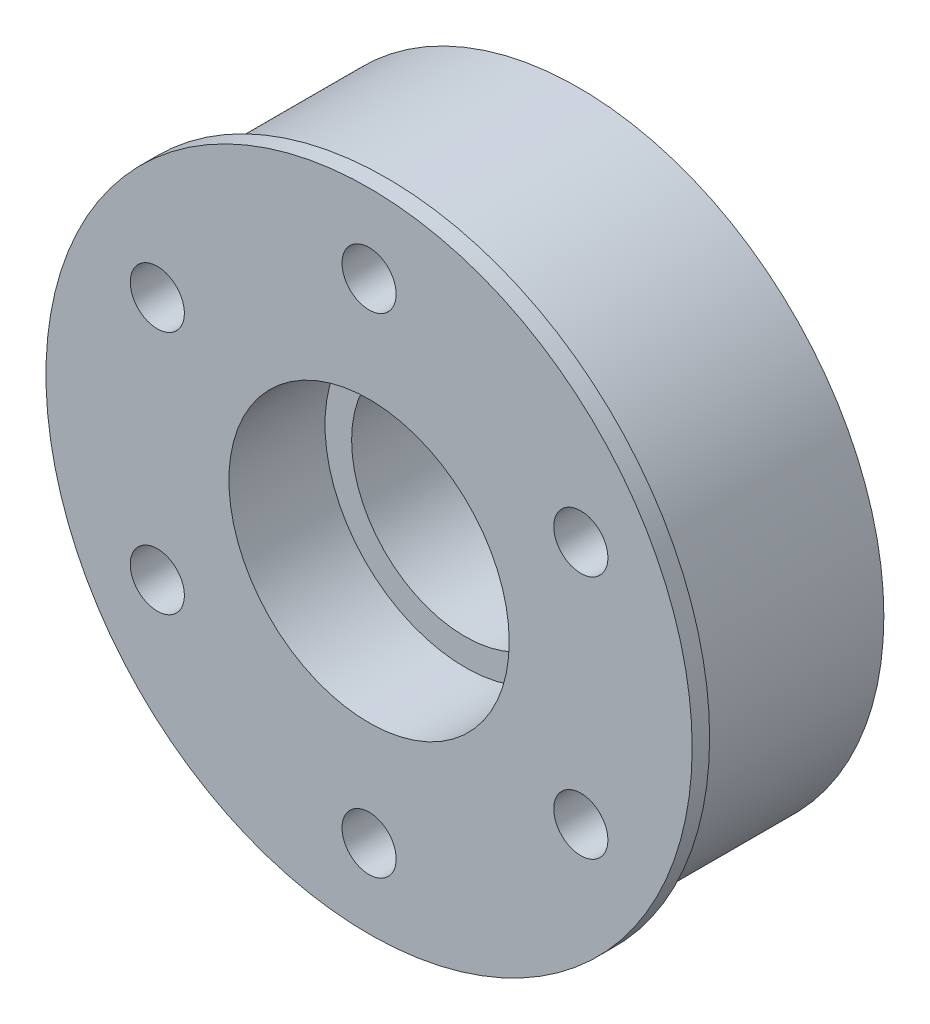
from build123d import *

# Parameters (mm, degrees)
SKETCH1_R             = 17.475
SKETCH1_R_2           = 8.025
BOSS_EXTRUDE1_DEPTH   = 12
CUT_EXTRUDE1_START    = 12
SKETCH1_3_R           = 1.55
CUT_EXTRUDE1_DEPTH    = 4
BOSS_EXTRUDE2_START   = 11
SKETCH1_4_R           = 18.5
SKETCH1_4_R_2         = 17.475
BOSS_EXTRUDE2_DEPTH   = 1
SKETCH2_R             = 8.025
SKETCH2_R_2           = 6.5
BOSS_EXTRUDE3_DEPTH   = 12
CUT_EXTRUDE2_START    = -6.5
SKETCH2_2_R           = 8.025
SKETCH2_2_R_2         = 6.5
CUT_EXTRUDE2_DEPTH    = 5.5
M5_TAPPED_HOLE1_D     = 4.2
M5_TAPPED_HOLE1_DEPTH = 8
M5_TAPPED_HOLE1_TIP   = 1.2618073


with BuildPart() as part:
    # Sketch1 → Boss-Extrude1 (new body)
    with BuildSketch(Plane.XY):
        Circle(SKETCH1_R)
        Circle(SKETCH1_R_2, mode=Mode.SUBTRACT)
    extrude(amount=BOSS_EXTRUDE1_DEPTH)

    # Sketch1<3> → Cut-Extrude1 (cut)
    with BuildSketch(Plane.XY.offset(CUT_EXTRUDE1_START)):
        with Locations((-12.124355653, 7)):
            Circle(SKETCH1_3_R)
        with BuildLine():
            ThreePointArc((0, 15.55), (-1.55, 14), (0, 12.45))
            Line((0, 12.45), (0, 15.55))
        make_face()
        with BuildLine():
            Line((0, 15.55), (0, 12.45))
            ThreePointArc((0, 12.45), (1.096015511, 12.903984489), (1.55, 14))
            ThreePointArc((1.55, 14), (1.096015511, 15.096015511), (0, 15.55))
        make_face()
        with Locations((12.124355653, 7)):
            Circle(SKETCH1_3_R)
        with Locations((12.124355653, -7)):
            Circle(SKETCH1_3_R)
        with Locations((0, -14)):
            Circle(SKETCH1_3_R)
        with Locations((-12.124355653, -7)):
            Circle(SKETCH1_3_R)
    extrude(amount=-CUT_EXTRUDE1_DEPTH, mode=Mode.SUBTRACT)

    # Sketch1<4> → Boss-Extrude2 (add)
    with BuildSketch(Plane.XY.offset(BOSS_EXTRUDE2_START)):
        Circle(SKETCH1_4_R)
        Circle(SKETCH1_4_R_2, mode=Mode.SUBTRACT)
    extrude(amount=BOSS_EXTRUDE2_DEPTH)

    # Sketch2 → Boss-Extrude3 (add)
    with BuildSketch(Plane(origin=(0, 0, 0), x_dir=(-1, 0, 0), z_dir=(0, 0, -1))):
        Circle(SKETCH2_R)
        Circle(SKETCH2_R_2, mode=Mode.SUBTRACT)
    extrude(amount=-BOSS_EXTRUDE3_DEPTH)

    # Sketch2<2> → Cut-Extrude2 (cut)
    with BuildSketch(Plane(origin=(0, 0, 0), x_dir=(-1, 0, 0), z_dir=(0, 0, -1)).offset(CUT_EXTRUDE2_START)):
        with Locations(Location((0, 0, 0), (0, 0, 180))):
            Circle(SKETCH2_2_R)
        Circle(SKETCH2_2_R_2, mode=Mode.SUBTRACT)
    extrude(amount=-CUT_EXTRUDE2_DEPTH, mode=Mode.SUBTRACT)

    # M5 Tapped Hole1
    with Locations(Plane(origin=(0, 0, 0), x_dir=(-1, 0, 0), z_dir=(0, 0, -1))):
        with Locations((-12, 0), (-6, -10.392304845), (6, -10.392304845), (6, 10.392304845), (12, 0), (-6, 10.392304845)):
            Hole(M5_TAPPED_HOLE1_D / 2, depth=M5_TAPPED_HOLE1_DEPTH)
            with Locations((0, 0, -(M5_TAPPED_HOLE1_DEPTH + M5_TAPPED_HOLE1_TIP / 2))):  # 118° drill point
                Cone(0, M5_TAPPED_HOLE1_D / 2, M5_TAPPED_HOLE1_TIP, mode=Mode.SUBTRACT)


solid = part.part
